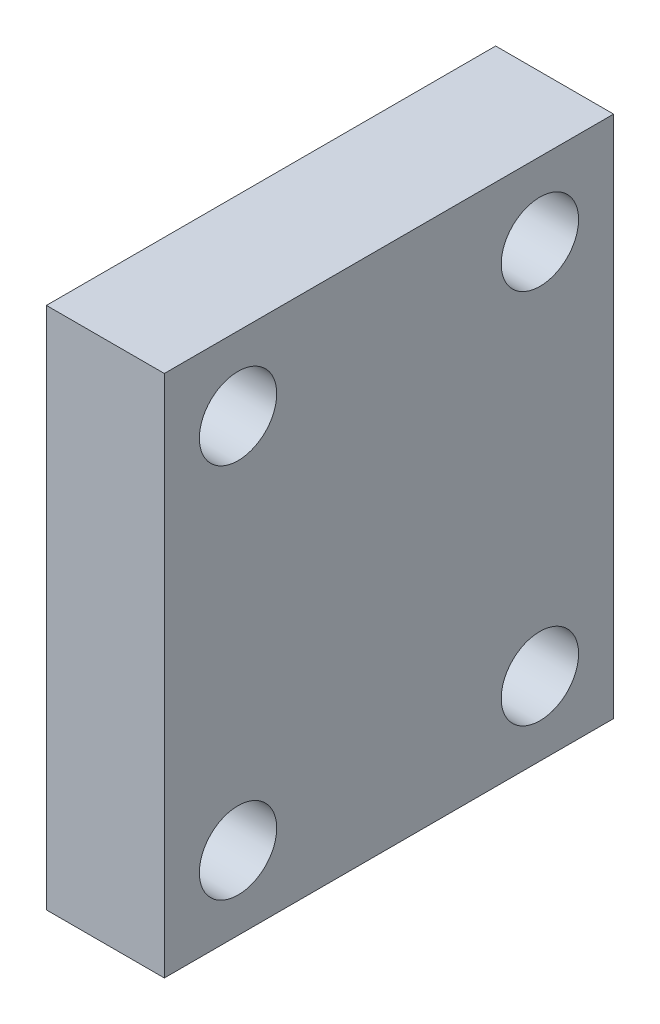
from build123d import *

# Parameters (mm, degrees)
SKETCH1_W           = 112.776
SKETCH1_H           = 96.774
BOSS_EXTRUDE1_DEPTH = 25.4
SKETCH2_R           = 8.334375
CUT_EXTRUDE2_DEPTH  = 151.760715215
SKETCH3_R           = 11.509375
CUT_EXTRUDE3_DEPTH  = 12.7
SKETCH4_R           = 11.509375
CUT_EXTRUDE4_DEPTH  = 12.7
SKETCH5_R           = 16.6497
CUT_EXTRUDE5_DEPTH  = 2.8194
SKETCH6_R           = 3.571875
CUT_EXTRUDE6_DEPTH  = 7.874
SKETCH8_R           = 3.175
CUT_EXTRUDE9_DEPTH  = 7.874
SKETCH9_R           = 3.175
BOSS_EXTRUDE2_DEPTH = 12.7


with BuildPart() as part:
    # Sketch1 → Boss-Extrude1 (new body)
    with BuildSketch(Plane.YZ):
        with Locations((56.388, 48.387)):
            Rectangle(SKETCH1_W, SKETCH1_H)
    extrude(amount=BOSS_EXTRUDE1_DEPTH)

    # Sketch2 → Cut-Extrude2 (cut, through all)
    with BuildSketch(Plane.YZ):
        with Locations(Location((15.875, 15.875, 0), (0, 0, 270))):
            Circle(SKETCH2_R)
        with Locations(Location((96.901, 15.875, 0), (0, 0, 270))):
            Circle(SKETCH2_R)
        with Locations(Location((15.875, 80.899, 0), (0, 0, 270))):
            Circle(SKETCH2_R)
        with Locations(Location((96.901, 80.899, 0), (0, 0, 270))):
            Circle(SKETCH2_R)
    extrude(amount=CUT_EXTRUDE2_DEPTH, mode=Mode.SUBTRACT)

    # Sketch3 → Cut-Extrude3 (cut)
    with BuildSketch(Plane.YZ):
        with Locations(Location((28.575, 48.387, 0), (0, 0, 270))):
            Circle(SKETCH3_R)
        with Locations(Location((74.549, 48.387, 0), (0, 0, 270))):
            Circle(SKETCH3_R)
    extrude(amount=CUT_EXTRUDE3_DEPTH, mode=Mode.SUBTRACT)

    # Sketch4 → Cut-Extrude4 (cut)
    with BuildSketch(Plane.YZ):
        with Locations((38.227, 48.387)):
            Circle(SKETCH4_R)
        with Locations((84.201, 48.387)):
            Circle(SKETCH4_R)
    extrude(amount=CUT_EXTRUDE4_DEPTH, mode=Mode.SUBTRACT)

    # Sketch5 → Cut-Extrude5 (cut)
    with BuildSketch(Plane.YZ):
        with Locations((38.227, 48.387)):
            Circle(SKETCH5_R)
        with Locations((84.201, 48.387)):
            Circle(SKETCH5_R)
    extrude(amount=CUT_EXTRUDE5_DEPTH, mode=Mode.SUBTRACT)

    # Sketch6 → Cut-Extrude6 (cut)
    with BuildSketch(Plane.YZ):
        with Locations(Location((105.537, 48.387, 0), (0, 0, 270))):
            Circle(SKETCH6_R)
        with Locations(Location((56.515, 15.875, 0), (0, 0, 270))):
            Circle(SKETCH6_R)
    extrude(amount=CUT_EXTRUDE6_DEPTH, mode=Mode.SUBTRACT)

    # Sketch8 → Cut-Extrude9 (cut)
    with BuildSketch(Plane.YZ):
        with Locations(Location((7.239, 48.387, 0), (0, 0, 270))):
            Circle(SKETCH8_R)
        with Locations(Location((56.261, 80.899, 0), (0, 0, 270))):
            Circle(SKETCH8_R)
    extrude(amount=CUT_EXTRUDE9_DEPTH, mode=Mode.SUBTRACT)

    # Sketch9 → Boss-Extrude2 (add)
    with BuildSketch(Plane.YZ):
        with Locations((0, 56.388)):
            Circle(SKETCH9_R)
    extrude(amount=BOSS_EXTRUDE2_DEPTH)


solid = part.part
